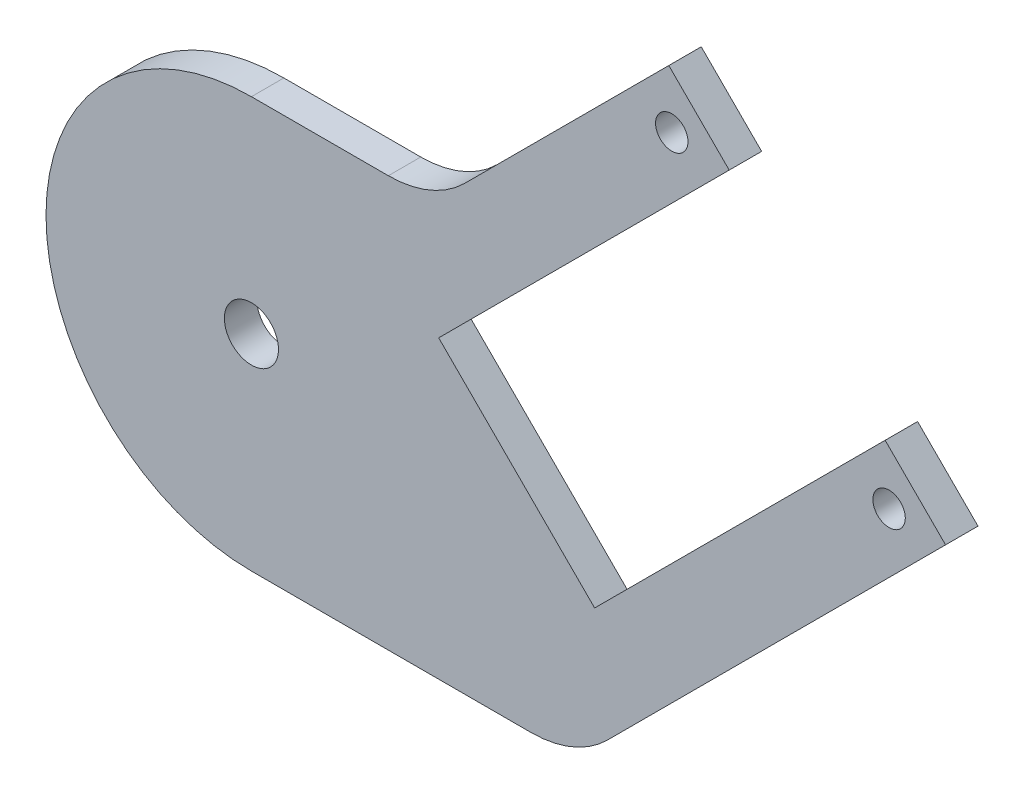
from build123d import *

# Parameters (mm, degrees)
SKETCH1_R           = 2.5
BOSS_EXTRUDE1_DEPTH = 3
SKETCH2_R           = 1.5
CUT_EXTRUDE1_DEPTH  = 77.127156728
FILLET1_R           = 10


with BuildPart() as part:
    # Sketch1 → Boss-Extrude1 (new body)
    with BuildSketch(Plane.XY):
        with BuildLine():
            Line((0, -19), (30, -19))
            Line((30, -19), (64.201367261, 15.201367261))
            Line((64.201367261, 15.201367261), (58.615223689, 20.787510832))
            Line((58.615223689, 20.787510832), (31.745166004, -6.082546853))
            Line((31.745166004, -6.082546853), (17.320187668, 8.342431483))
            Line((17.320187668, 8.342431483), (44.190245353, 35.212489168))
            Line((44.190245353, 35.212489168), (38.604101782, 40.798632739))
            Line((38.604101782, 40.798632739), (16.805469042, 19))
            Line((16.805469042, 19), (0, 19))
            ThreePointArc((0, 19), (-19, 0), (0, -19))
        make_face()
        Circle(SKETCH1_R, mode=Mode.SUBTRACT)
    extrude(amount=BOSS_EXTRUDE1_DEPTH)

    # Sketch2 → Cut-Extrude1 (cut, through all)
    with BuildSketch(Plane.XY.offset(3)):
        with Locations((38.878105659, 35.574881393)):
            Circle(SKETCH2_R)
        with Locations((58.977615915, 15.475371138)):
            Circle(SKETCH2_R)
    extrude(amount=-CUT_EXTRUDE1_DEPTH, mode=Mode.SUBTRACT)

    # Fillet1
    fillet1_edges = [part.edges().sort_by_distance(p)[0] for p in [
        (16.805469042, 19, 1.5),
        (30, -19, 1.5),
    ]]
    fillet(fillet1_edges, radius=FILLET1_R)


solid = part.part
